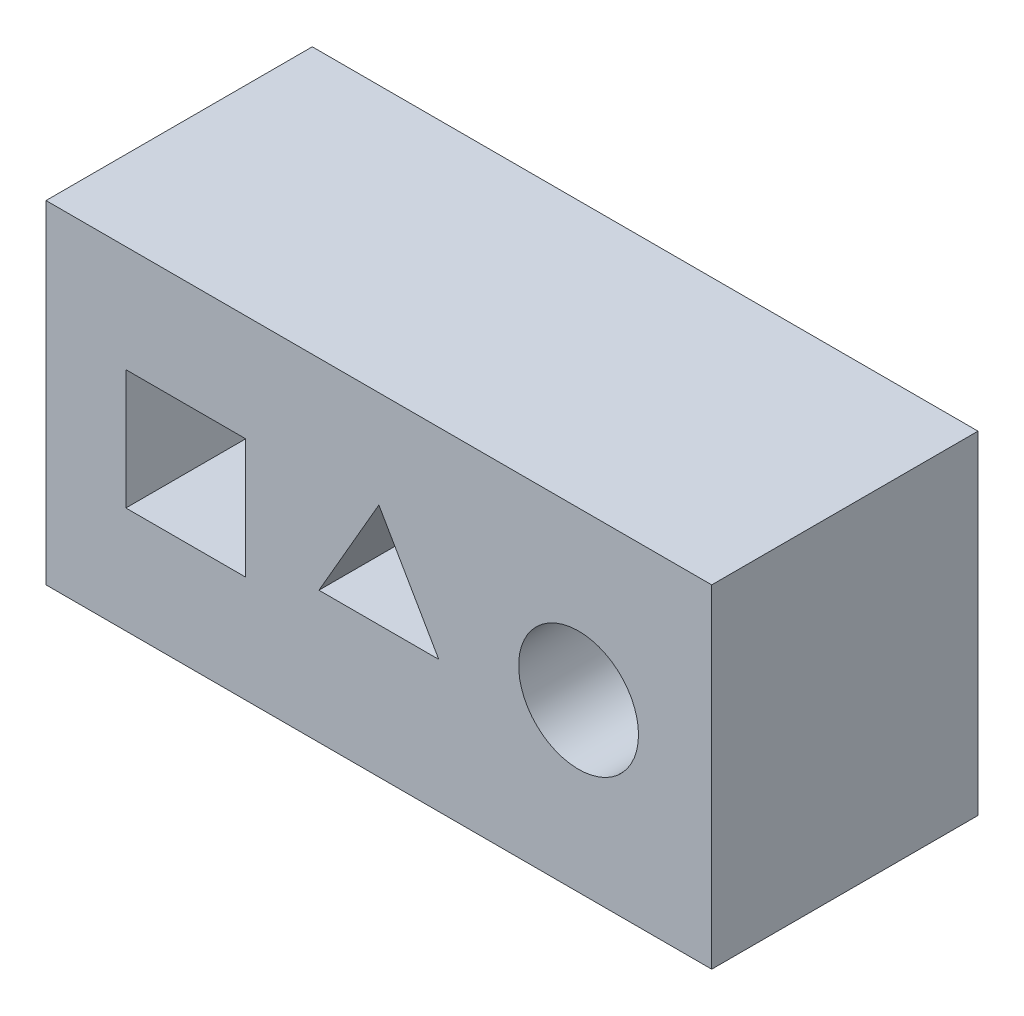
from build123d import *

# Parameters (mm, degrees)
SKETCH1_W           = 250
SKETCH1_H           = 125
SKETCH1_W_2         = 230
SKETCH1_H_2         = 115
BOSS_EXTRUDE1_DEPTH = 100
SKETCH3_W           = 250
SKETCH3_H           = 125
SKETCH3_W_2         = 230
SKETCH3_H_2         = 115
SKETCH3_R           = 22.5
SKETCH3_W_3         = 45
SKETCH3_H_3         = 45
BOSS_EXTRUDE4_DEPTH = 100


with BuildPart() as part:
    # Sketch1 → Boss-Extrude1 (new body)
    with BuildSketch(Plane.XY):
        Rectangle(SKETCH1_W, SKETCH1_H)
        Rectangle(SKETCH1_W_2, SKETCH1_H_2, mode=Mode.SUBTRACT)
    extrude(amount=BOSS_EXTRUDE1_DEPTH)

    # Sketch3 → Boss-Extrude4 (add)
    # profile 1 of 2: a face of its own
    with BuildSketch(Plane.XY.offset(100)):
        Rectangle(SKETCH3_W, SKETCH3_H)
        Rectangle(SKETCH3_W_2, SKETCH3_H_2, mode=Mode.SUBTRACT)
    # profile 2 of 2: a face of its own
    with BuildSketch(Plane.XY.offset(100)):
        Rectangle(SKETCH3_W_2, SKETCH3_H_2)
        with Locations((75, 0)):
            Circle(SKETCH3_R, mode=Mode.SUBTRACT)
        with Locations((-72.5, 0)):
            Rectangle(SKETCH3_W_3, SKETCH3_H_3, mode=Mode.SUBTRACT)
        Polygon((0, 25.980762114), (22.5, -12.990381057), (-22.5, -12.990381057), align=None, mode=Mode.SUBTRACT)
    extrude(amount=-BOSS_EXTRUDE4_DEPTH)


solid = part.part
